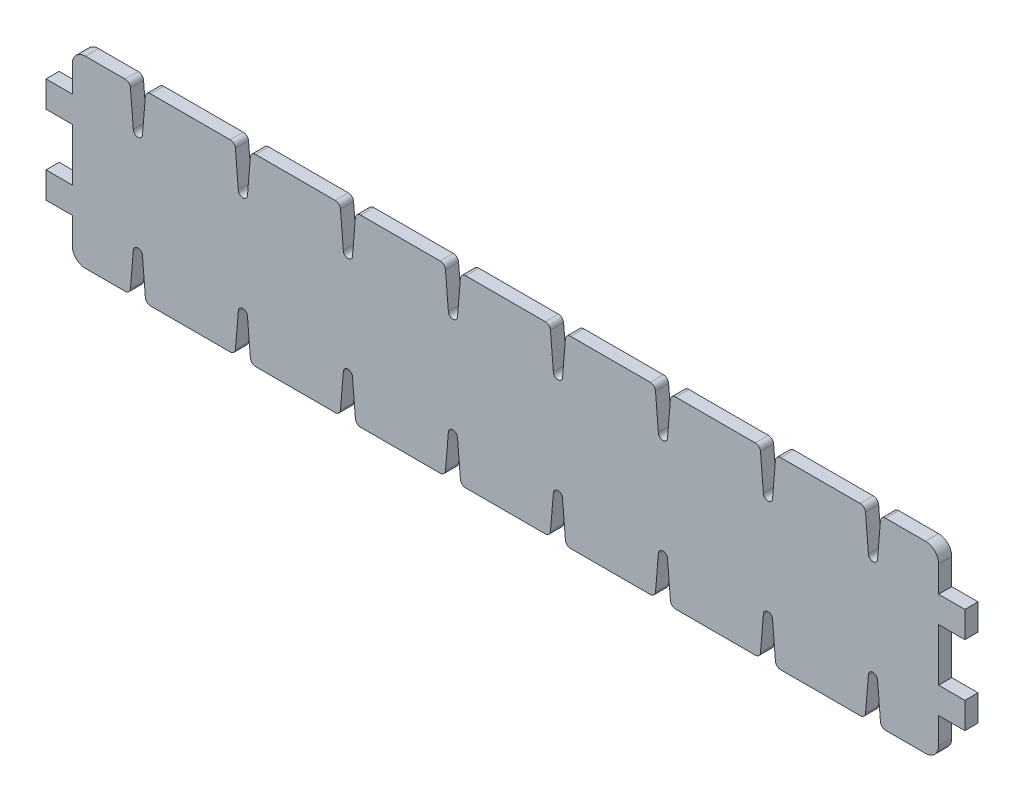
from build123d import *

# Parameters (mm, degrees)
BOSS_EXTRUDE1_DEPTH = 5
CUT_EXTRUDE1_DEPTH  = 5
FILLET1_R           = 2
CONG_1_R            = 5


with BuildPart() as part:
    # Sketch1 → Boss-Extrude1 (new body)
    with BuildSketch(Plane.XY):
        Polygon((-75.813253012, 35), (254.186746988, 35), (254.186746988, 20), (264.186746988, 20), (264.186746988, 10), (254.186746988, 10), (254.186746988, -10), (264.186746988, -10), (264.186746988, -20), (254.186746988, -20), (254.186746988, -35), (-75.813253012, -35), (-75.813253012, -20), (-85.813253012, -20), (-85.813253012, -10), (-75.813253012, -10), (-75.813253012, 10), (-85.813253012, 10), (-85.813253012, 20), (-75.813253012, 20), align=None)
    extrude(amount=BOSS_EXTRUDE1_DEPTH)

    # Sketch2 → Cut-Extrude1 (cut)
    with BuildSketch(Plane.XY.offset(5)):
        with BuildLine():
            Line((-53.813253012, 35), (-47.813253012, 35))
            Line((-47.813253012, 35), (-49.063253012, 20))
            ThreePointArc((-49.063253012, 20), (-50.813253012, 18.25), (-52.563253012, 20))
            Line((-52.563253012, 20), (-53.813253012, 35))
        make_face()
        with BuildLine():
            Line((-13.813253012, 35), (-7.813253012, 35))
            Line((-7.813253012, 35), (-9.063253012, 20))
            ThreePointArc((-9.063253012, 20), (-10.813253012, 18.25), (-12.563253012, 20))
            Line((-12.563253012, 20), (-13.813253012, 35))
        make_face()
        with BuildLine():
            Line((26.186746988, 35), (32.186746988, 35))
            Line((32.186746988, 35), (30.936746988, 20))
            ThreePointArc((30.936746988, 20), (29.186746988, 18.25), (27.436746988, 20))
            Line((27.436746988, 20), (26.186746988, 35))
        make_face()
        with BuildLine():
            Line((66.186746988, 35), (72.186746988, 35))
            Line((72.186746988, 35), (70.936746988, 20))
            ThreePointArc((70.936746988, 20), (69.186746988, 18.25), (67.436746988, 20))
            Line((67.436746988, 20), (66.186746988, 35))
        make_face()
        with BuildLine():
            Line((106.186746988, 35), (112.186746988, 35))
            Line((112.186746988, 35), (110.936746988, 20))
            ThreePointArc((110.936746988, 20), (109.186746988, 18.25), (107.436746988, 20))
            Line((107.436746988, 20), (106.186746988, 35))
        make_face()
        with BuildLine():
            Line((146.186746988, 35), (152.186746988, 35))
            Line((152.186746988, 35), (150.936746988, 20))
            ThreePointArc((150.936746988, 20), (149.186746988, 18.25), (147.436746988, 20))
            Line((147.436746988, 20), (146.186746988, 35))
        make_face()
        with BuildLine():
            Line((186.186746988, 35), (192.186746988, 35))
            Line((192.186746988, 35), (190.936746988, 20))
            ThreePointArc((190.936746988, 20), (189.186746988, 18.25), (187.436746988, 20))
            Line((187.436746988, 20), (186.186746988, 35))
        make_face()
        with BuildLine():
            Line((226.186746988, 35), (232.186746988, 35))
            Line((232.186746988, 35), (230.936746988, 20))
            ThreePointArc((230.936746988, 20), (229.186746988, 18.25), (227.436746988, 20))
            Line((227.436746988, 20), (226.186746988, 35))
        make_face()
        with BuildLine():
            Line((232.186746988, -35), (230.936746988, -20))
            ThreePointArc((230.936746988, -20), (229.186746988, -18.25), (227.436746988, -20))
            Line((227.436746988, -20), (226.186746988, -35))
            Line((226.186746988, -35), (232.186746988, -35))
        make_face()
        with BuildLine():
            Line((192.186746988, -35), (190.936746988, -20))
            ThreePointArc((190.936746988, -20), (189.186746988, -18.25), (187.436746988, -20))
            Line((187.436746988, -20), (186.186746988, -35))
            Line((186.186746988, -35), (192.186746988, -35))
        make_face()
        with BuildLine():
            Line((152.186746988, -35), (150.936746988, -20))
            ThreePointArc((150.936746988, -20), (149.186746988, -18.25), (147.436746988, -20))
            Line((147.436746988, -20), (146.186746988, -35))
            Line((146.186746988, -35), (152.186746988, -35))
        make_face()
        with BuildLine():
            Line((112.186746988, -35), (110.936746988, -20))
            ThreePointArc((110.936746988, -20), (109.186746988, -18.25), (107.436746988, -20))
            Line((107.436746988, -20), (106.186746988, -35))
            Line((106.186746988, -35), (112.186746988, -35))
        make_face()
        with BuildLine():
            Line((72.186746988, -35), (70.936746988, -20))
            ThreePointArc((70.936746988, -20), (69.186746988, -18.25), (67.436746988, -20))
            Line((67.436746988, -20), (66.186746988, -35))
            Line((66.186746988, -35), (72.186746988, -35))
        make_face()
        with BuildLine():
            Line((32.186746988, -35), (30.936746988, -20))
            ThreePointArc((30.936746988, -20), (29.186746988, -18.25), (27.436746988, -20))
            Line((27.436746988, -20), (26.186746988, -35))
            Line((26.186746988, -35), (32.186746988, -35))
        make_face()
        with BuildLine():
            Line((-7.813253012, -35), (-9.063253012, -20))
            ThreePointArc((-9.063253012, -20), (-10.813253012, -18.25), (-12.563253012, -20))
            Line((-12.563253012, -20), (-13.813253012, -35))
            Line((-13.813253012, -35), (-7.813253012, -35))
        make_face()
        with BuildLine():
            Line((-47.813253012, -35), (-49.063253012, -20))
            ThreePointArc((-49.063253012, -20), (-50.813253012, -18.25), (-52.563253012, -20))
            Line((-52.563253012, -20), (-53.813253012, -35))
            Line((-53.813253012, -35), (-47.813253012, -35))
        make_face()
    extrude(amount=-CUT_EXTRUDE1_DEPTH, mode=Mode.SUBTRACT)

    # Fillet1
    fillet1_edges = [part.edges().sort_by_distance(p)[0] for p in [
        (-13.813253012, 35, 2.5),
        (-7.813253012, 35, 2.5),
        (26.186746988, 35, 2.5),
        (32.186746988, 35, 2.5),
        (66.186746988, 35, 2.5),
        (72.186746988, 35, 2.5),
        (106.186746988, 35, 2.5),
        (112.186746988, 35, 2.5),
        (146.186746988, 35, 2.5),
        (152.186746988, 35, 2.5),
        (186.186746988, 35, 2.5),
        (192.186746988, 35, 2.5),
        (226.186746988, 35, 2.5),
        (232.186746988, 35, 2.5),
        (232.186746988, -35, 2.5),
        (226.186746988, -35, 2.5),
        (192.186746988, -35, 2.5),
        (186.186746988, -35, 2.5),
        (152.186746988, -35, 2.5),
        (146.186746988, -35, 2.5),
        (112.186746988, -35, 2.5),
        (106.186746988, -35, 2.5),
        (72.186746988, -35, 2.5),
        (66.186746988, -35, 2.5),
        (32.186746988, -35, 2.5),
        (26.186746988, -35, 2.5),
        (-7.813253012, -35, 2.5),
        (-13.813253012, -35, 2.5),
        (-47.813253012, -35, 2.5),
        (-53.813253012, -35, 2.5),
        (-53.813253012, 35, 2.5),
        (-47.813253012, 35, 2.5),
    ]]
    fillet(fillet1_edges, radius=FILLET1_R)

    # Congé1
    cong_1_edges = [part.edges().sort_by_distance(p)[0] for p in [
        (-75.813253012, 35, 2.5),
        (254.186746988, 35, 2.5),
        (254.186746988, -35, 2.5),
        (-75.813253012, -35, 2.5),
    ]]
    fillet(cong_1_edges, radius=CONG_1_R)


solid = part.part
